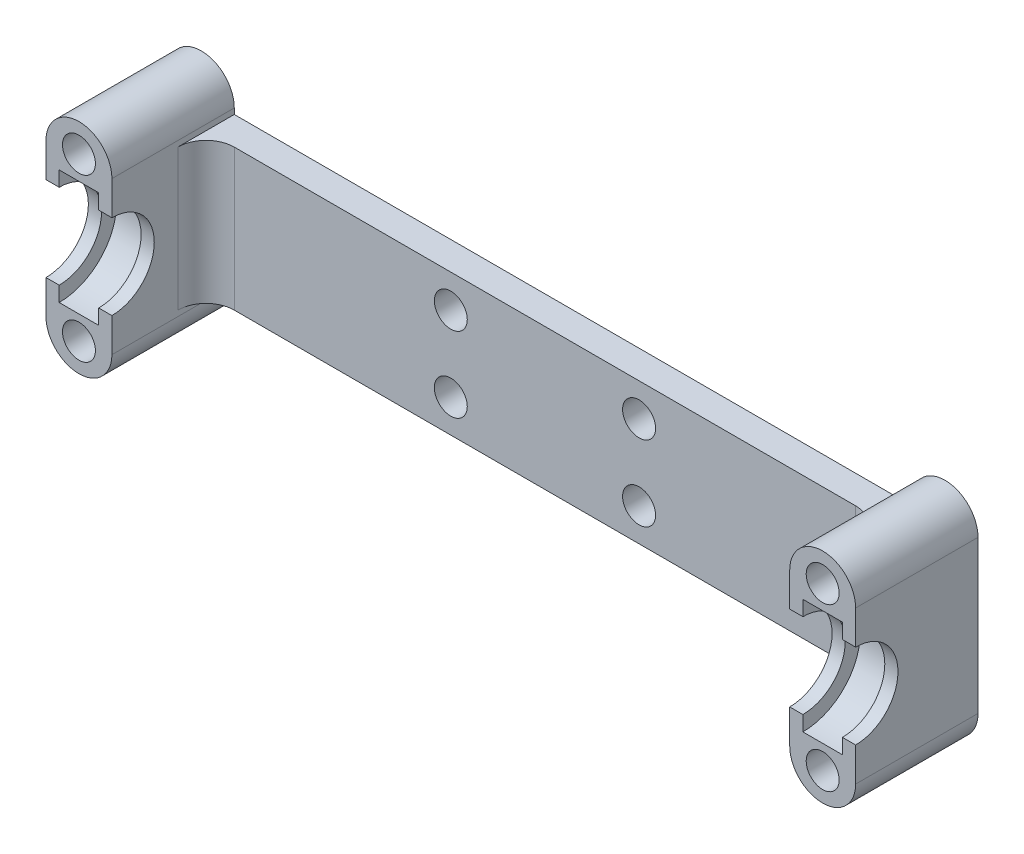
from build123d import *

# Parameters (mm, degrees)
SKETCH1_W                                  = 86
SKETCH1_H                                  = 15
BOSS_EXTRUDE1_DEPTH                        = 3
SKETCH2_W                                  = 7
SKETCH2_H                                  = 15
BOSS_EXTRUDE2_DEPTH                        = 10
SKETCH5_R                                  = 4.5
CUT_EXTRUDE1_DEPTH                         = 88.299770905
SKETCH6_R                                  = 6.1
CUT_EXTRUDE4_DEPTH                         = 2.1
BOSS_EXTRUDE3_DEPTH                        = 13
SKETCH8_R                                  = 1.75
CUT_EXTRUDE5_DEPTH                         = 47.395689455
SKETCH9_R                                  = 1.75
CUT_EXTRUDE6_DEPTH                         = 46.6460294
MIRROR1_AT_THE_SECOND_PLANE_COPY_1_SKETC_R = 6.1
MIRROR1_AT_THE_SECOND_PLANE_COPY_1_DEPTH   = 2.1
MIRROR1_AT_THE_SECOND_PLANE_COPY_2_DEPTH   = 13
MIRROR1_AT_THE_SECOND_PLANE_COPY_3_SKETC_R = 1.75
MIRROR1_AT_THE_SECOND_PLANE_COPY_3_DEPTH   = 47.395689455
MIRROR1_AT_THE_SECOND_PLANE_COPY_4_SKETC_R = 1.75
MIRROR1_AT_THE_SECOND_PLANE_COPY_4_DEPTH   = 46.6460294
FILLET1_R                                  = 3


with BuildPart() as part:
    # Sketch1 → Boss-Extrude1 (new body)
    with BuildSketch(Plane.XY):
        Rectangle(SKETCH1_W, SKETCH1_H)
    extrude(amount=BOSS_EXTRUDE1_DEPTH)

    # Sketch2 → Boss-Extrude2 (add)
    with BuildSketch(Plane.XY.offset(3)):
        with Locations((-39.5, 0)):
            Rectangle(SKETCH2_W, SKETCH2_H)
        with Locations((39.5, 0)):
            Rectangle(SKETCH2_W, SKETCH2_H)
    extrude(amount=BOSS_EXTRUDE2_DEPTH)

    # Sketch5 → Cut-Extrude1 (cut, through all)
    with BuildSketch(Plane(origin=(43, 0, 0), x_dir=(0, 0, -1), z_dir=(1, 0, 0))):
        with Locations((-13, 0)):
            Circle(SKETCH5_R)
    extrude(amount=-CUT_EXTRUDE1_DEPTH, mode=Mode.SUBTRACT)

    # Sketch6 → Cut-Extrude4 (cut, symmetric)
    with BuildSketch(Plane(origin=(39.5, 0, 0), x_dir=(0, 0, -1), z_dir=(1, 0, 0))):
        with Locations((-13, 0)):
            Circle(SKETCH6_R)
    cut_extrude4 = extrude(amount=CUT_EXTRUDE4_DEPTH, both=True, mode=Mode.SUBTRACT)

    # Sketch7 → Boss-Extrude3 (add)
    with BuildSketch(Plane.XY):
        with BuildLine():
            Line((37.4, 6.1), (41.6, 6.1))
            Line((41.6, 6.1), (41.6, 4.5))
            Line((41.6, 4.5), (43, 4.5))
            Line((43, 4.5), (43, 8.1))
            ThreePointArc((43, 8.1), (39.5, 11.6), (36, 8.1))
            Line((36, 8.1), (36, 4.5))
            Line((36, 4.5), (37.4, 4.5))
            Line((37.4, 4.5), (37.4, 6.1))
        make_face()
    boss_extrude3 = extrude(amount=BOSS_EXTRUDE3_DEPTH)

    # Sketch8 → Cut-Extrude5 (cut, symmetric)
    with BuildSketch(Plane.XY.offset(13)):
        with Locations((39.5, 8.6)):
            Circle(SKETCH8_R)
    cut_extrude5 = extrude(amount=CUT_EXTRUDE5_DEPTH, both=True, mode=Mode.SUBTRACT)

    # Sketch9 → Cut-Extrude6 (cut, through all)
    with BuildSketch(Plane.XY.offset(3)):
        with Locations((-10, -4)):
            Circle(SKETCH9_R)
    cut_extrude6 = extrude(amount=-CUT_EXTRUDE6_DEPTH, mode=Mode.SUBTRACT)

    # Mirror1: Cut-Extrude4, Boss-Extrude3, Cut-Extrude5, Cut-Extrude6 across plane
    add(cut_extrude4.mirror(Plane(origin=(0, 0, 0), x_dir=(0, 0, 1), z_dir=(1, 0, 0))), mode=Mode.SUBTRACT)
    add(boss_extrude3.mirror(Plane(origin=(0, 0, 0), x_dir=(0, 0, 1), z_dir=(1, 0, 0))))
    add(cut_extrude5.mirror(Plane(origin=(0, 0, 0), x_dir=(0, 0, 1), z_dir=(1, 0, 0))), mode=Mode.SUBTRACT)
    add(cut_extrude6.mirror(Plane(origin=(0, 0, 0), x_dir=(0, 0, 1), z_dir=(1, 0, 0))), mode=Mode.SUBTRACT)

    # Mirror1 at the second plane: Cut-Extrude4, Boss-Extrude3, Cut-Extrude5, Cut-Extrude6 across plane
    add(cut_extrude4.mirror(Plane.ZX), mode=Mode.SUBTRACT)
    add(boss_extrude3.mirror(Plane.ZX))
    add(cut_extrude5.mirror(Plane.ZX), mode=Mode.SUBTRACT)
    add(cut_extrude6.mirror(Plane.ZX), mode=Mode.SUBTRACT)

    # Mirror1 at the second plane copy 1 sketc → Mirror1 at the second plane copy 1 (cut, symmetric)
    with BuildSketch(Plane(origin=(-39.5, 0, 0), x_dir=(0, 0, -1), z_dir=(-1, 0, 0))):
        with Locations((-13, 0)):
            Circle(MIRROR1_AT_THE_SECOND_PLANE_COPY_1_SKETC_R)
    extrude(amount=MIRROR1_AT_THE_SECOND_PLANE_COPY_1_DEPTH, both=True, mode=Mode.SUBTRACT)

    # Mirror1 at the second plane copy 2 sketc → Mirror1 at the second plane copy 2 (add)
    with BuildSketch(Plane(origin=(0, 0, 0), x_dir=(-1, 0, 0), z_dir=(0, 0, 1))):
        with BuildLine():
            Line((37.4, 6.1), (41.6, 6.1))
            Line((41.6, 6.1), (41.6, 4.5))
            Line((41.6, 4.5), (43, 4.5))
            Line((43, 4.5), (43, 8.1))
            ThreePointArc((43, 8.1), (39.5, 11.6), (36, 8.1))
            Line((36, 8.1), (36, 4.5))
            Line((36, 4.5), (37.4, 4.5))
            Line((37.4, 4.5), (37.4, 6.1))
        make_face()
    extrude(amount=MIRROR1_AT_THE_SECOND_PLANE_COPY_2_DEPTH)

    # Mirror1 at the second plane copy 3 sketc → Mirror1 at the second plane copy 3 (cut, symmetric)
    with BuildSketch(Plane(origin=(0, 0, 13), x_dir=(-1, 0, 0), z_dir=(0, 0, 1))):
        with Locations((39.5, 8.6)):
            Circle(MIRROR1_AT_THE_SECOND_PLANE_COPY_3_SKETC_R)
    extrude(amount=MIRROR1_AT_THE_SECOND_PLANE_COPY_3_DEPTH, both=True, mode=Mode.SUBTRACT)

    # Mirror1 at the second plane copy 4 sketc → Mirror1 at the second plane copy 4 (cut, through all)
    with BuildSketch(Plane(origin=(0, 0, 3), x_dir=(-1, 0, 0), z_dir=(0, 0, 1))):
        with Locations((-10, -4)):
            Circle(MIRROR1_AT_THE_SECOND_PLANE_COPY_4_SKETC_R)
    extrude(amount=-MIRROR1_AT_THE_SECOND_PLANE_COPY_4_DEPTH, mode=Mode.SUBTRACT)

    # Fillet1
    fillet1_edges = [part.edges().sort_by_distance(p)[0] for p in [
        (-36, 0, 3),
        (36, 0, 3),
    ]]
    fillet(fillet1_edges, radius=FILLET1_R)


solid = part.part
